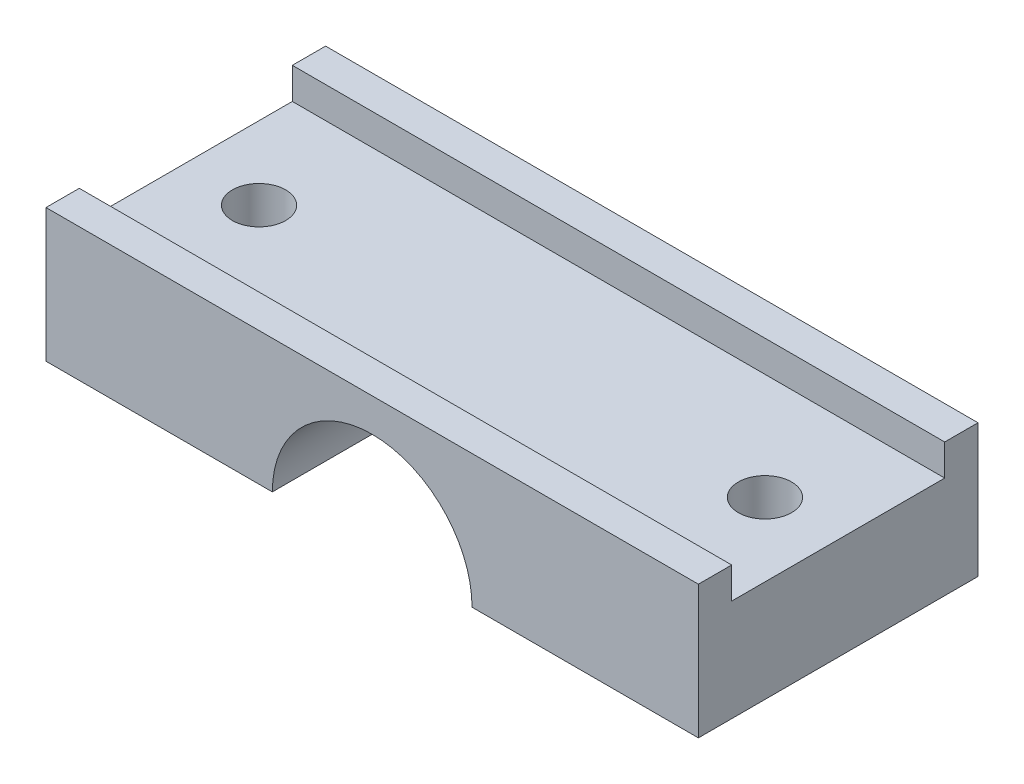
from build123d import *

# Parameters (mm, degrees)
SKETCH2_W           = 98
SKETCH2_H           = 20
BOSS_EXTRUDE1_DEPTH = 42
SKETCH4_W           = 32
SKETCH4_H           = 4.7
CUT_EXTRUDE1_DEPTH  = 109.480412979
SKETCH6_R           = 4
CUT_EXTRUDE3_DEPTH  = 108.712998287
SKETCH7_R           = 15
CUT_EXTRUDE4_DEPTH  = 109.480412979


with BuildPart() as part:
    # Sketch2 → Boss-Extrude1 (new body)
    with BuildSketch(Plane.XY):
        with Locations((49, 10)):
            Rectangle(SKETCH2_W, SKETCH2_H)
    extrude(amount=BOSS_EXTRUDE1_DEPTH)

    # Sketch4 → Cut-Extrude1 (cut, through all)
    with BuildSketch(Plane(origin=(98, 0, 0), x_dir=(0, 0, -1), z_dir=(1, 0, 0))):
        with Locations((-21, 17.65)):
            Rectangle(SKETCH4_W, SKETCH4_H)
    extrude(amount=-CUT_EXTRUDE1_DEPTH, mode=Mode.SUBTRACT)

    # Sketch6 → Cut-Extrude3 (cut, through all)
    with BuildSketch(Plane(origin=(0, 15.3, 0), x_dir=(1, 0, 0), z_dir=(0, 1, 0))):
        with Locations(Location((11, -21, 0), (0, 0, 270))):
            Circle(SKETCH6_R)
        with Locations(Location((87, -21, 0), (0, 0, 90))):
            Circle(SKETCH6_R)
    extrude(amount=-CUT_EXTRUDE3_DEPTH, mode=Mode.SUBTRACT)

    # Sketch7 → Cut-Extrude4 (cut, through all)
    with BuildSketch(Plane.XY.offset(42)):
        with Locations((49, 0)):
            Circle(SKETCH7_R)
    extrude(amount=-CUT_EXTRUDE4_DEPTH, mode=Mode.SUBTRACT)


solid = part.part
